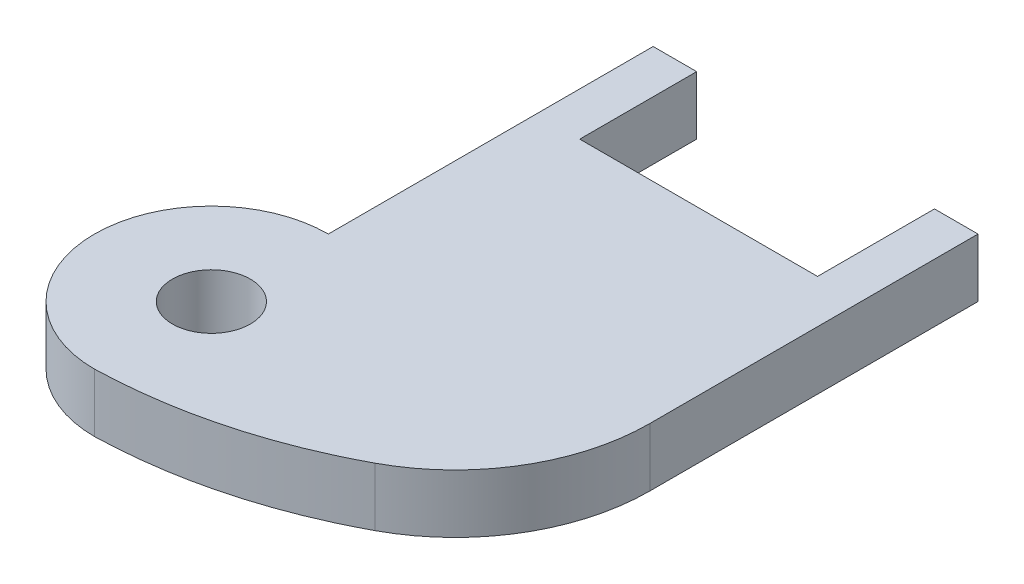
from build123d import *

# Parameters (mm, degrees)
SKETCH_1_R      = 2
EXTRUDE_1_DEPTH = 3
FILLET_1_R      = 10


with BuildPart() as part:
    # 草图1 → 凸台-拉伸1 (new body)
    with BuildSketch(Plane(origin=(0, 0, 0), x_dir=(1, 0, 0), z_dir=(0, 1, 0))):
        with BuildLine():
            Line((2.233333333, 0), (0, 0))
            Line((0, 0), (0, -16.666666667))
            ThreePointArc((0, -16.666666667), (-6, -22.666666667), (0, -28.666666667))
            add(Edge.make_bspline(
                [(0, -28.666666667), (9.212627714, -28.392938173), (16.666666667, -22)],
                knots=[0, 0, 0, 1, 1, 1], degree=2))
            Line((16.666666667, -22), (16.666666667, 0))
            Line((16.666666667, 0), (14.433333333, 0))
            Line((14.433333333, 0), (14.433333333, -6))
            Line((14.433333333, -6), (2.233333333, -6))
            Line((2.233333333, -6), (2.233333333, 0))
        make_face()
        with Locations(Location((0, -22.666666667, 0), (0, 0, 270))):
            Circle(SKETCH_1_R, mode=Mode.SUBTRACT)
    extrude(amount=EXTRUDE_1_DEPTH)

    # 圆角1
    fillet_1_edges = [part.edges().sort_by_distance(p)[0] for p in [
        (16.666666667, 1.5, 22),
    ]]
    fillet(fillet_1_edges, radius=FILLET_1_R)


solid = part.part
